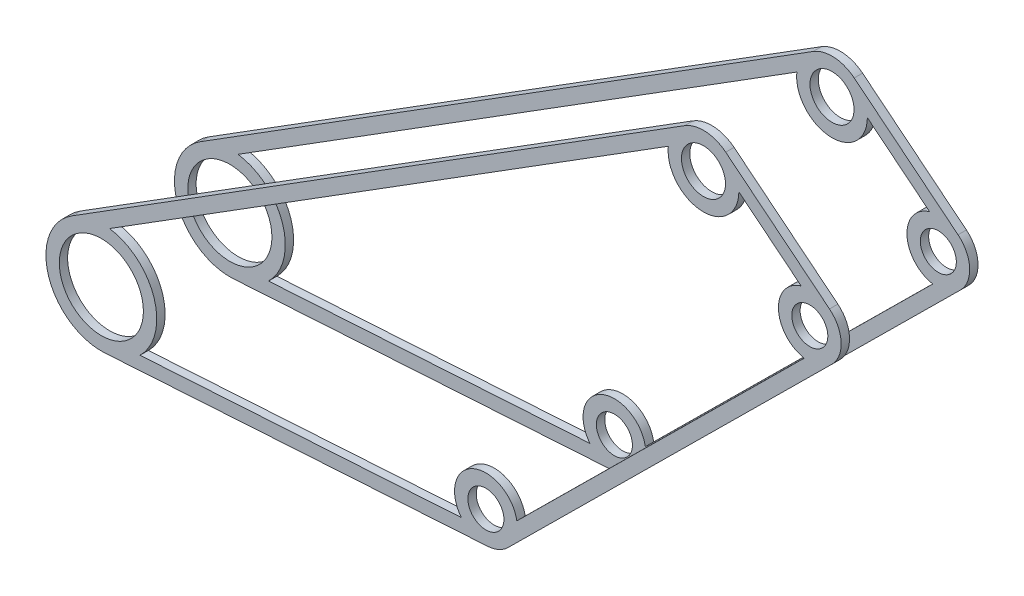
from build123d import *

# Parameters (mm, degrees)
BOSS_EXTRUDE1_START = 11.43
SKETCH1_R           = 8.001
SKETCH1_R_2         = 4.191
SKETCH1_R_3         = 3.429
BOSS_EXTRUDE1_DEPTH = 1.5875
BOSS_EXTRUDE2_START = -11.43
SKETCH1_4_R         = 8.001
SKETCH1_4_R_2       = 4.191
SKETCH1_4_R_3       = 3.429
BOSS_EXTRUDE2_DEPTH = 1.5875


with BuildPart() as part:
    # Sketch1 → Boss-Extrude1 (new body)
    with BuildSketch(Plane.XY.offset(BOSS_EXTRUDE1_START)):
        with BuildLine():
            ThreePointArc((-5.602921506, 8.928603004), (-10.033788157, -3.230445203), (0.6588125, -10.520391965))
            Line((0.6588125, -10.520391965), (73.5250625, -5.95733039))
            ThreePointArc((73.5250625, -5.95733039), (75.594137082, -5.446551888), (77.351889102, -4.241449344))
            Line((77.351889102, -4.241449344), (138.965814226, 56.768745915))
            ThreePointArc((138.965814226, 56.768745915), (140.72734131, 61.310990973), (138.517547945, 65.652854757))
            Line((138.517547945, 65.652854757), (118.770442282, 81.610021609))
            ThreePointArc((118.770442282, 81.610021609), (114.940930349, 83.093724275), (110.962119735, 82.076079274))
            Line((110.962119735, 82.076079274), (-5.602921506, 8.928603004))
        make_face()
        Circle(SKETCH1_R, mode=Mode.SUBTRACT)
        with BuildLine():
            Line((1.560133531, 10.424905964), (107.850836903, 77.124978473))
            ThreePointArc((107.850836903, 77.124978473), (114.138847429, 69.655640074), (121.27069795, 76.323983244))
            Line((121.27069795, 76.323983244), (133.120970638, 66.748059473))
            ThreePointArc((133.120970638, 66.748059473), (128.804508939, 60.709399545), (133.706886647, 55.135895428))
            Line((133.706886647, 55.135895428), (79.036442978, 1.001145266))
            ThreePointArc((79.036442978, 1.001145266), (70.709862918, 5.446551888), (68.490076839, -3.727657903))
            Line((68.490076839, -3.727657903), (7.349347762, -7.556438876))
            ThreePointArc((7.349347762, -7.556438876), (10.033788157, 3.230445203), (1.560133531, 10.424905964))
        make_face(mode=Mode.SUBTRACT)
        with Locations((114.539888889, 76.374682175)):
            Circle(SKETCH1_R_2, mode=Mode.SUBTRACT)
        with Locations((73.152, 0)):
            Circle(SKETCH1_R_3, mode=Mode.SUBTRACT)
        with Locations((134.765925125, 61.010195259)):
            Circle(SKETCH1_R_3, mode=Mode.SUBTRACT)
    extrude(amount=BOSS_EXTRUDE1_DEPTH)


with BuildPart() as body_2:
    # Sketch1<4> → Boss-Extrude2 (new body)
    with BuildSketch(Plane.XY.offset(BOSS_EXTRUDE2_START)):
        with BuildLine():
            ThreePointArc((-5.602921506, 8.928603004), (-10.033788157, -3.230445203), (0.6588125, -10.520391965))
            Line((0.6588125, -10.520391965), (73.5250625, -5.95733039))
            ThreePointArc((73.5250625, -5.95733039), (75.594137082, -5.446551888), (77.351889102, -4.241449344))
            Line((77.351889102, -4.241449344), (138.965814226, 56.768745915))
            ThreePointArc((138.965814226, 56.768745915), (140.72734131, 61.310990973), (138.517547945, 65.652854757))
            Line((138.517547945, 65.652854757), (118.770442282, 81.610021609))
            ThreePointArc((118.770442282, 81.610021609), (114.940930349, 83.093724275), (110.962119735, 82.076079274))
            Line((110.962119735, 82.076079274), (-5.602921506, 8.928603004))
        make_face()
        Circle(SKETCH1_4_R, mode=Mode.SUBTRACT)
        with BuildLine():
            Line((1.560133531, 10.424905964), (107.850836903, 77.124978473))
            ThreePointArc((107.850836903, 77.124978473), (114.138847429, 69.655640074), (121.27069795, 76.323983244))
            Line((121.27069795, 76.323983244), (133.120970638, 66.748059473))
            ThreePointArc((133.120970638, 66.748059473), (128.804508939, 60.709399545), (133.706886647, 55.135895428))
            Line((133.706886647, 55.135895428), (79.036442978, 1.001145266))
            ThreePointArc((79.036442978, 1.001145266), (70.709862918, 5.446551888), (68.490076839, -3.727657903))
            Line((68.490076839, -3.727657903), (7.349347762, -7.556438876))
            ThreePointArc((7.349347762, -7.556438876), (10.033788157, 3.230445203), (1.560133531, 10.424905964))
        make_face(mode=Mode.SUBTRACT)
        with Locations((114.539888889, 76.374682175)):
            Circle(SKETCH1_4_R_2, mode=Mode.SUBTRACT)
        with Locations((73.152, 0)):
            Circle(SKETCH1_4_R_3, mode=Mode.SUBTRACT)
        with Locations((134.765925125, 61.010195259)):
            Circle(SKETCH1_4_R_3, mode=Mode.SUBTRACT)
    extrude(amount=-BOSS_EXTRUDE2_DEPTH)


solid = Compound([part.part, body_2.part])
